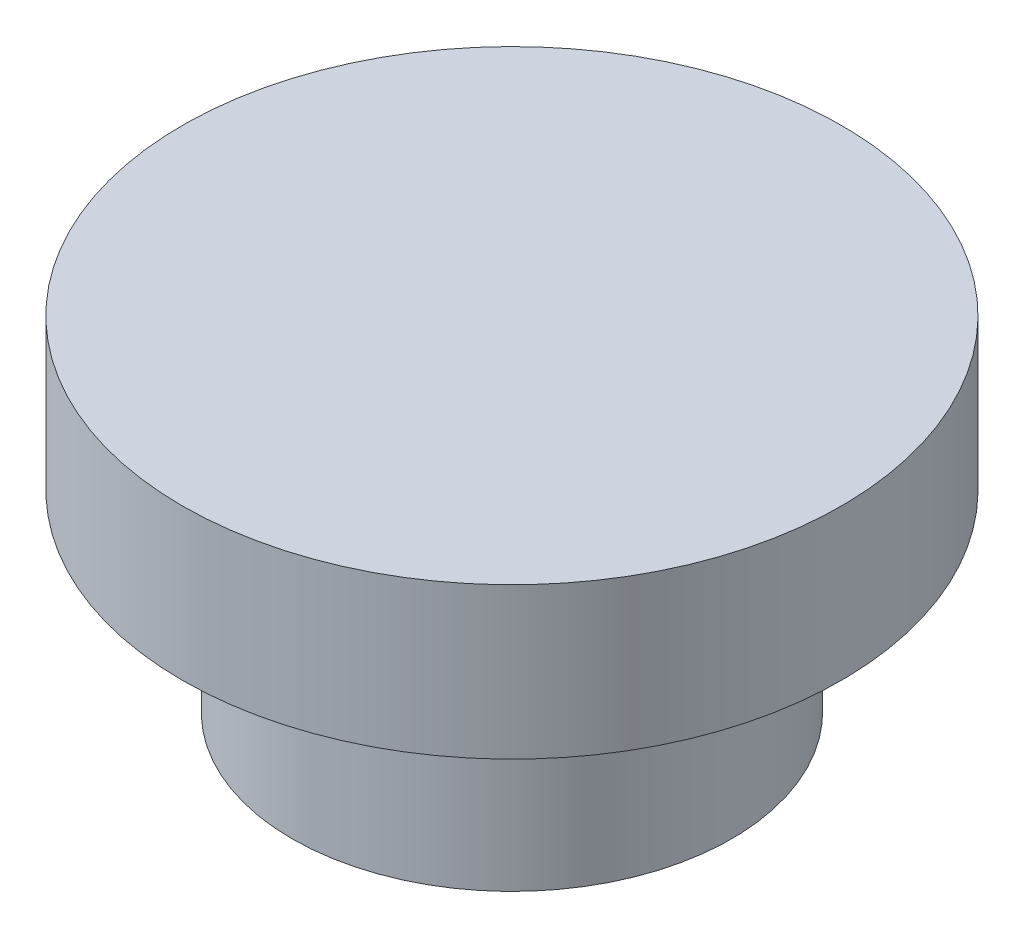
from build123d import *

# Parameters (mm, degrees)
SKETCH2_R            = 50.8
INJECTORMAN_DEPTH    = 50.8
SKETCH3_R            = 44.120125769
SKETCH3_R_2          = 38.536533444
OXMAN1_DEPTH         = 44.45
SKETCH4_R            = 30.48
SKETCH4_R_2          = 25.4
FUELMAN_DEPTH        = 44.45
SKETCH5_R            = 18.457900086
SKETCH5_R_2          = 13.335918013
OXMAN2_DEPTH         = 44.45
SKETCH6_R            = 76.2
SKETCH6_W            = 10.16
SKETCH6_H            = 3.81
REGENDIST_DEPTH      = 25.4
SKETCH7_R            = 76.2
SKETCH7_R_2          = 69.85
REGENTOFUELMAN_DEPTH = 6.35
SKETCH8_R            = 76.2
FUELMANLID_DEPTH     = 3.175
SKETCH10_R           = 30.48
SKETCH10_R_2         = 25.4
CUT_EXTRUDE4_DEPTH   = 25.4
SKETCH11_R           = 50.8
CUT_EXTRUDE5_DEPTH   = 6.35


with BuildPart() as part:
    # Sketch2 → InjectorMan (new body)
    with BuildSketch(Plane(origin=(0, 0, 0), x_dir=(1, 0, 0), z_dir=(0, 1, 0))):
        with Locations(Location((0, 0, 0), (0, 0, 270))):
            Circle(SKETCH2_R)
    extrude(amount=INJECTORMAN_DEPTH)

    # Sketch3 → OxMan1 (cut)
    with BuildSketch(Plane(origin=(0, 50.8, 0), x_dir=(1, 0, 0), z_dir=(0, 1, 0))):
        with Locations(Location((0, 0, 0), (0, 0, 270))):
            Circle(SKETCH3_R)
        with Locations(Location((0, 0, 0), (0, 0, 270))):
            Circle(SKETCH3_R_2, mode=Mode.SUBTRACT)
    extrude(amount=-OXMAN1_DEPTH, mode=Mode.SUBTRACT)

    # Sketch4 → FuelMan (cut)
    with BuildSketch(Plane(origin=(0, 50.8, 0), x_dir=(1, 0, 0), z_dir=(0, 1, 0))):
        with Locations(Location((0, 0, 0), (0, 0, 270))):
            Circle(SKETCH4_R)
        with Locations(Location((0, 0, 0), (0, 0, 270))):
            Circle(SKETCH4_R_2, mode=Mode.SUBTRACT)
    extrude(amount=-FUELMAN_DEPTH, mode=Mode.SUBTRACT)

    # Sketch5 → OxMan2 (cut)
    with BuildSketch(Plane(origin=(0, 50.8, 0), x_dir=(1, 0, 0), z_dir=(0, 1, 0))):
        with Locations(Location((0, 0, 0), (0, 0, 270))):
            Circle(SKETCH5_R)
        with Locations(Location((0, 0, 0), (0, 0, 270))):
            Circle(SKETCH5_R_2, mode=Mode.SUBTRACT)
    extrude(amount=-OXMAN2_DEPTH, mode=Mode.SUBTRACT)

    # Sketch6 → RegenDist (add)
    with BuildSketch(Plane(origin=(0, 50.8, 0), x_dir=(1, 0, 0), z_dir=(0, 1, 0))):
        with Locations(Location((0, 0, 0), (0, 0, 270))):
            Circle(SKETCH6_R)
        with Locations((-64.77, 0)):
            Rectangle(SKETCH6_W, SKETCH6_H, mode=Mode.SUBTRACT)
        Polygon((-69.067632648, 10.597813235), (-59.070908028, 8.783675184), (-58.390606259, 12.532446917), (-68.387330879, 14.346584968), align=None, mode=Mode.SUBTRACT)
        Polygon((-66.065374754, 22.760004034), (-56.553228468, 19.190035821), (-55.214490389, 22.757090678), (-64.726636674, 26.327058891), align=None, mode=Mode.SUBTRACT)
        Polygon((-60.939721357, 34.190669575), (-52.217881614, 28.979612917), (-50.263735367, 32.25030282), (-58.98557511, 37.461359479), align=None, mode=Mode.SUBTRACT)
        Polygon((-53.855415173, 44.522418864), (-46.204209079, 37.837761409), (-43.697462533, 40.706963694), (-51.348668627, 47.39162115), align=None, mode=Mode.SUBTRACT)
        Polygon((-45.040151634, 53.423180978), (-38.705495247, 45.479773116), (-35.726717299, 47.855269261), (-42.061373686, 55.798677123), align=None, mode=Mode.SUBTRACT)
        Polygon((-34.777260562, 60.606878098), (-29.962754951, 51.660027495), (-26.607685975, 53.465467099), (-31.422191586, 62.412317702), align=None, mode=Mode.SUBTRACT)
        Polygon((-23.396599721, 65.842620289), (-20.256987058, 56.179886083), (-16.633461731, 57.357240832), (-19.773074394, 67.019975038), align=None, mode=Mode.SUBTRACT)
        Polygon((-11.263952914, 68.962126488), (-9.900142933, 58.894076909), (-6.12462434, 59.405505651), (-7.488434321, 69.473555231), align=None, mode=Mode.SUBTRACT)
        Polygon((1.230726608, 69.8651332), (0.774899932, 59.715363644), (4.581063515, 59.54442864), (5.036890192, 69.694198196), align=None, mode=Mode.SUBTRACT)
        Polygon((13.685849564, 68.522617045), (11.425036875, 58.617349457), (15.139512221, 57.769544699), (17.40032491, 67.674812287), align=None, mode=Mode.SUBTRACT)
        Polygon((25.701098054, 64.977727598), (21.707963733, 55.635325429), (25.211364546, 54.137900058), (29.204498868, 63.480302227), align=None, mode=Mode.SUBTRACT)
        Polygon((36.890292106, 59.344400522), (31.293178775, 50.865136264), (34.472902871, 48.766218765), (40.070016203, 57.245483023), align=None, mode=Mode.SUBTRACT)
        Polygon((46.893801816, 51.803695585), (39.872605302, 44.460099768), (42.626453734, 41.827151076), (49.647650247, 49.170746892), align=None, mode=Mode.SUBTRACT)
        Polygon((55.390106151, 42.597977247), (47.170493489, 36.626079084), (49.4099553, 33.543724335), (57.629567963, 39.515622498), align=None, mode=Mode.SUBTRACT)
        Polygon((62.1061269, 32.023124871), (52.952283202, 27.614866081), (54.605380248, 24.182174695), (63.759223946, 28.590433484), align=None, mode=Mode.SUBTRACT)
        Polygon((66.826005629, 20.419022912), (57.032142964, 17.716088562), (58.045743346, 14.043390062), (67.83960601, 16.746324413), align=None, mode=Mode.SUBTRACT)
        Polygon((69.398041552, 8.158636757), (59.278942725, 7.247901379), (59.620468492, 3.453239318), (69.739567319, 4.363974697), align=None, mode=Mode.SUBTRACT)
        Polygon((69.739567319, -4.363974697), (59.620468492, -3.453239318), (59.278942725, -7.247901379), (69.398041552, -8.158636757), align=None, mode=Mode.SUBTRACT)
        Polygon((67.83960601, -16.746324413), (58.045743346, -14.043390062), (57.032142964, -17.716088562), (66.826005629, -20.419022912), align=None, mode=Mode.SUBTRACT)
        Polygon((63.759223946, -28.590433484), (54.605380248, -24.182174695), (52.952283202, -27.614866081), (62.1061269, -32.023124871), align=None, mode=Mode.SUBTRACT)
        Polygon((57.629567963, -39.515622498), (49.4099553, -33.543724335), (47.170493489, -36.626079084), (55.390106151, -42.597977247), align=None, mode=Mode.SUBTRACT)
        Polygon((49.647650247, -49.170746892), (42.626453734, -41.827151076), (39.872605302, -44.460099768), (46.893801816, -51.803695585), align=None, mode=Mode.SUBTRACT)
        Polygon((40.070016203, -57.245483023), (34.472902871, -48.766218765), (31.293178775, -50.865136264), (36.890292106, -59.344400522), align=None, mode=Mode.SUBTRACT)
        Polygon((29.204498868, -63.480302227), (25.211364546, -54.137900058), (21.707963733, -55.635325429), (25.701098054, -64.977727598), align=None, mode=Mode.SUBTRACT)
        Polygon((17.40032491, -67.674812287), (15.139512221, -57.769544699), (11.425036875, -58.617349457), (13.685849564, -68.522617045), align=None, mode=Mode.SUBTRACT)
        Polygon((5.036890192, -69.694198196), (4.581063515, -59.54442864), (0.774899932, -59.715363644), (1.230726608, -69.8651332), align=None, mode=Mode.SUBTRACT)
        Polygon((-7.488434321, -69.473555231), (-6.12462434, -59.405505651), (-9.900142933, -58.894076909), (-11.263952914, -68.962126488), align=None, mode=Mode.SUBTRACT)
        Polygon((-19.773074394, -67.019975038), (-16.633461731, -57.357240832), (-20.256987058, -56.179886083), (-23.396599721, -65.842620289), align=None, mode=Mode.SUBTRACT)
        Polygon((-31.422191586, -62.412317702), (-26.607685975, -53.465467099), (-29.962754951, -51.660027495), (-34.777260562, -60.606878098), align=None, mode=Mode.SUBTRACT)
        Polygon((-42.061373686, -55.798677123), (-35.726717299, -47.855269261), (-38.705495247, -45.479773116), (-45.040151634, -53.423180978), align=None, mode=Mode.SUBTRACT)
        Polygon((-51.348668627, -47.39162115), (-43.697462533, -40.706963694), (-46.204209079, -37.837761409), (-53.855415173, -44.522418864), align=None, mode=Mode.SUBTRACT)
        Polygon((-58.98557511, -37.461359479), (-50.263735367, -32.25030282), (-52.217881614, -28.979612917), (-60.939721357, -34.190669575), align=None, mode=Mode.SUBTRACT)
        Polygon((-64.726636674, -26.327058891), (-55.214490389, -22.757090678), (-56.553228468, -19.190035821), (-66.065374754, -22.760004034), align=None, mode=Mode.SUBTRACT)
        Polygon((-68.387330879, -14.346584968), (-58.390606259, -12.532446917), (-59.070908028, -8.783675184), (-69.067632648, -10.597813235), align=None, mode=Mode.SUBTRACT)
    extrude(amount=REGENDIST_DEPTH)

    # Sketch7 → RegenToFuelMan (add)
    with BuildSketch(Plane(origin=(0, 76.2, 0), x_dir=(1, 0, 0), z_dir=(0, 1, 0))):
        with Locations(Location((0, 0, 0), (0, 0, 270))):
            Circle(SKETCH7_R)
        with Locations(Location((0, 0, 0), (0, 0, 88.991377374))):
            Circle(SKETCH7_R_2, mode=Mode.SUBTRACT)
    extrude(amount=REGENTOFUELMAN_DEPTH)

    # Sketch8 → FuelManLid (add)
    with BuildSketch(Plane(origin=(0, 82.55, 0), x_dir=(1, 0, 0), z_dir=(0, 1, 0))):
        with Locations(Location((0, 0, 0), (0, 0, 270))):
            Circle(SKETCH8_R)
    extrude(amount=FUELMANLID_DEPTH)

    # Sketch10 → Cut-Extrude4 (cut)
    with BuildSketch(Plane(origin=(0, 76.2, 0), x_dir=(1, 0, 0), z_dir=(0, 1, 0))):
        with Locations(Location((0, 0, 0), (0, 0, 270))):
            Circle(SKETCH10_R)
        with Locations(Location((0, 0, 0), (0, 0, 270))):
            Circle(SKETCH10_R_2, mode=Mode.SUBTRACT)
    extrude(amount=-CUT_EXTRUDE4_DEPTH, mode=Mode.SUBTRACT)

    # Sketch11 → Cut-Extrude5 (cut)
    with BuildSketch(Plane.XZ):
        with Locations(Location((0, 0, 0), (0, 0, 270))):
            Circle(SKETCH11_R)
    extrude(amount=-CUT_EXTRUDE5_DEPTH, mode=Mode.SUBTRACT)


with BuildPart() as cut_extrude5_piece_1:
    # of the separate pieces the step leaves, piece 1, a body of its own (cut_extrude5_pieces)
    add(part.part.solids().sort_by_distance((0, 50.8, 76.2))[0])


with BuildPart() as cut_extrude5_piece_2:
    # of the separate pieces the step leaves, piece 2, a body of its own (cut_extrude5_pieces)
    add(part.part.solids().sort_by_distance((0, 6.35, 25.4))[0])


solid = Compound([cut_extrude5_piece_1.part, cut_extrude5_piece_2.part])
